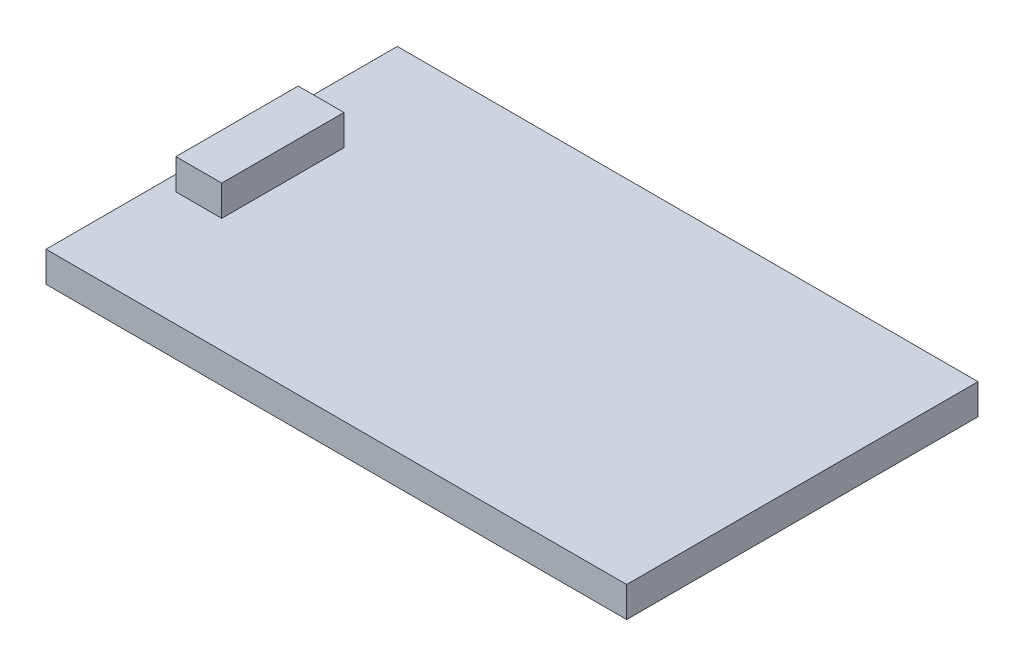
from build123d import *

# Parameters (mm, degrees)
SKETCH1_W           = 38
SKETCH1_H           = 22.99
BOSS_EXTRUDE1_DEPTH = 1.99
SKETCH2_W           = 3
SKETCH2_H           = 8
BOSS_EXTRUDE2_DEPTH = 2


with BuildPart() as part:
    # Sketch1 → Boss-Extrude1 (new body)
    with BuildSketch(Plane(origin=(0, 0, 0), x_dir=(1, 0, 0), z_dir=(0, 1, 0))):
        Rectangle(SKETCH1_W, SKETCH1_H)
    extrude(amount=BOSS_EXTRUDE1_DEPTH)

    # Sketch2 → Boss-Extrude2 (add)
    with BuildSketch(Plane(origin=(0, 1.99, 0), x_dir=(1, 0, 0), z_dir=(0, 1, 0))):
        with Locations((-16.5, 0.005)):
            Rectangle(SKETCH2_W, SKETCH2_H)
    extrude(amount=BOSS_EXTRUDE2_DEPTH)


solid = part.part
